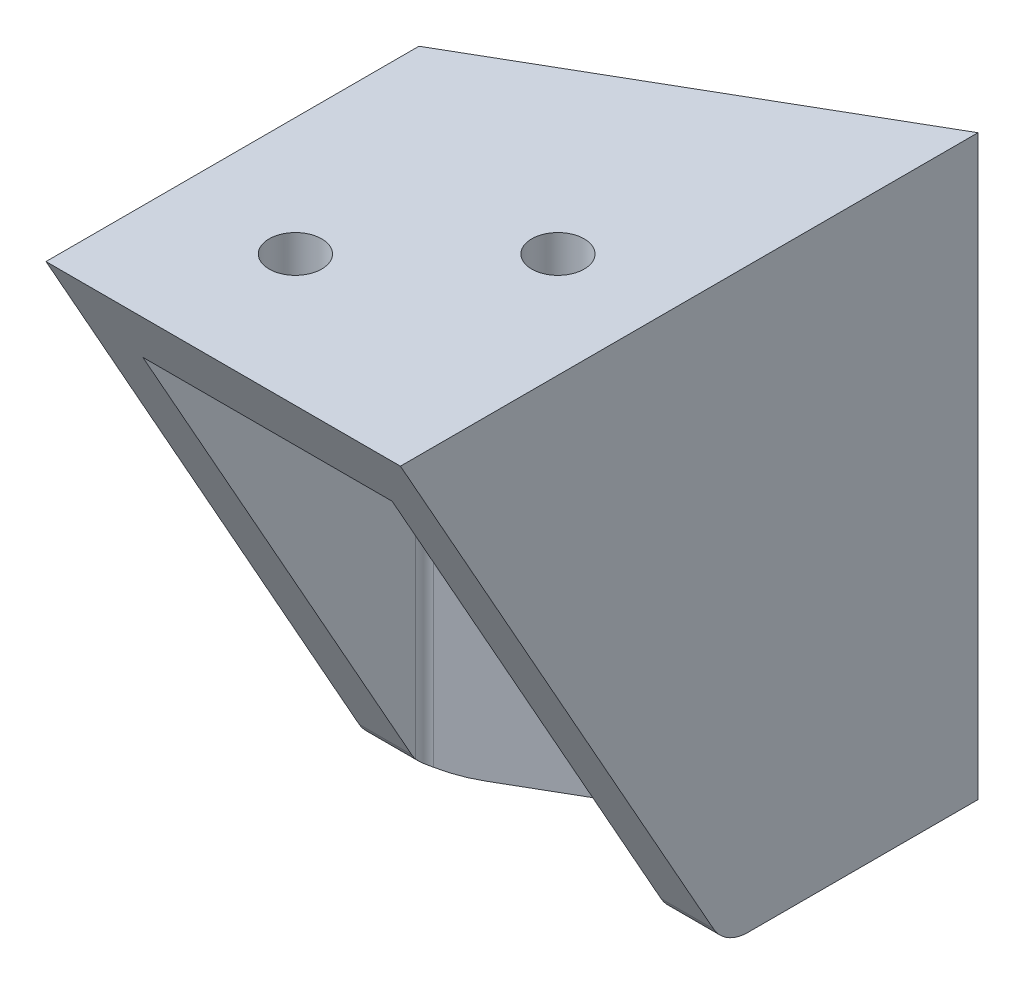
from build123d import *

# Parameters (mm, degrees)
SKETCH1_W           = 27
SKETCH1_H           = 44
BOSS_EXTRUDE1_DEPTH = 6
CUT_EXTRUDE1_DEPTH  = 27.5
BOSS_EXTRUDE2_DEPTH = 44
SKETCH4_R           = 2
CUT_EXTRUDE2_DEPTH  = 46.937457483
SKETCH7_R           = 2.05
CUT_EXTRUDE4_DEPTH  = 54.81893677
CUT_EXTRUDE6_DEPTH  = 52.546096044
FILLET1_R           = 1
FILLET2_R           = 3


with BuildPart() as part:
    # Sketch1 → Boss-Extrude1 (new body)
    with BuildSketch(Plane(origin=(0, 0, 0), x_dir=(1, 0, 0), z_dir=(0, 1, 0))):
        Rectangle(SKETCH1_W, SKETCH1_H)
    extrude(amount=BOSS_EXTRUDE1_DEPTH)

    # Sketch2 → Cut-Extrude1 (cut, through all)
    with BuildSketch(Plane(origin=(0, 6, 0), x_dir=(1, 0, 0), z_dir=(0, 1, 0))):
        Polygon((13.5, 22), (-13.5, 6.411542732), (-13.5, 22), align=None)
    extrude(amount=-CUT_EXTRUDE1_DEPTH, mode=Mode.SUBTRACT)

    # Sketch3 → Boss-Extrude2 (add)
    with BuildSketch(Plane(origin=(0, 6, 0), x_dir=(1, 0, 0), z_dir=(0, 1, 0))):
        Polygon((-13.5, 6.411542732), (13.5, 22), (13.5, 16), (-13.5, 0.411542732), align=None)
    extrude(amount=-BOSS_EXTRUDE2_DEPTH)

    # Sketch4 → Cut-Extrude2 (cut, through all)
    with BuildSketch(Plane.XZ):
        with Locations(Location((-4.5, 12, 0), (0, 0, 270))):
            Circle(SKETCH4_R)
        with Locations(Location((5.5, 2, 0), (0, 0, 270))):
            Circle(SKETCH4_R)
    extrude(amount=-CUT_EXTRUDE2_DEPTH, mode=Mode.SUBTRACT)

    # Sketch7 → Cut-Extrude4 (cut, through all)
    with BuildSketch(Plane(origin=(-6.151279442, 0, -10.654328524), x_dir=(-0.8660254037844417, 0, 0.49999999999999495), z_dir=(-0.49999999999999495, 0, -0.8660254037844417))):
        with Locations((-5.514428415, -13)):
            Circle(SKETCH7_R)
        with Locations((-0.514428415, -25.5)):
            Circle(SKETCH7_R)
    extrude(amount=-CUT_EXTRUDE4_DEPTH, mode=Mode.SUBTRACT)

    # Sketch15 → Loft5 section 0
    with BuildSketch(Plane(origin=(9.5, 0, 0), x_dir=(0, 0, -1), z_dir=(1, 0, 0))):
        with BuildLine():
            Line((-22, 0), (13.690598923, 0))
            Line((13.690598923, 0), (13.690598923, -38))
            Line((13.690598923, -38), (-22, -38))
            Line((-22, -38), (-22, 0))
        make_face()
    # Sketch17 → Loft5 section 1
    with BuildSketch(Plane(origin=(13.5, 0, 0), x_dir=(0, 0, -1), z_dir=(1, 0, 0))):
        with BuildLine():
            Line((-22, 0), (16, 0))
            Line((16, 0), (16, -38))
            Line((16, -38), (-22, -38))
            Line((-22, -38), (-22, 0))
        make_face()
    loft()

    # Sketch12 → Loft7 section 0
    with BuildSketch(Plane.ZY.offset(9.5)):
        with BuildLine():
            Line((-2.720943809, -38), (-2.720943809, 0))
            Line((-2.720943809, 0), (22, 0))
            Line((22, 0), (22, -38))
            Line((22, -38), (-2.720943809, -38))
        make_face()
    # Sketch20 → Loft7 section 1
    with BuildSketch(Plane.ZY.offset(13.5)):
        with BuildLine():
            Line((-0.411542732, 0), (22, 0))
            Line((22, 0), (22, -38))
            Line((22, -38), (-0.411542732, -38))
            Line((-0.411542732, -38), (-0.411542732, 0))
        make_face()
    loft()

    # Sketch22 → Cut-Extrude6 (cut, through all)
    with BuildSketch(Plane.ZY.offset(13.5)):
        Polygon((22, 6), (-2.721542732, -38), (22, -38), align=None)
    extrude(amount=-CUT_EXTRUDE6_DEPTH, mode=Mode.SUBTRACT)

    # Fillet1
    fillet1_edges = [part.edges().sort_by_distance(p)[0] for p in [
        (9.5, -19, -13.690598923),
        (-9.5, -18.999467011, -2.720943809),
    ]]
    fillet(fillet1_edges, radius=FILLET1_R)

    # Fillet2
    fillet2_edges = [part.edges().sort_by_distance(p)[0] for p in [
        (-11.408036374, -38, -2.721542732),
        (11.5, -38, -2.721542732),
    ]]
    fillet(fillet2_edges, radius=FILLET2_R)


solid = part.part
